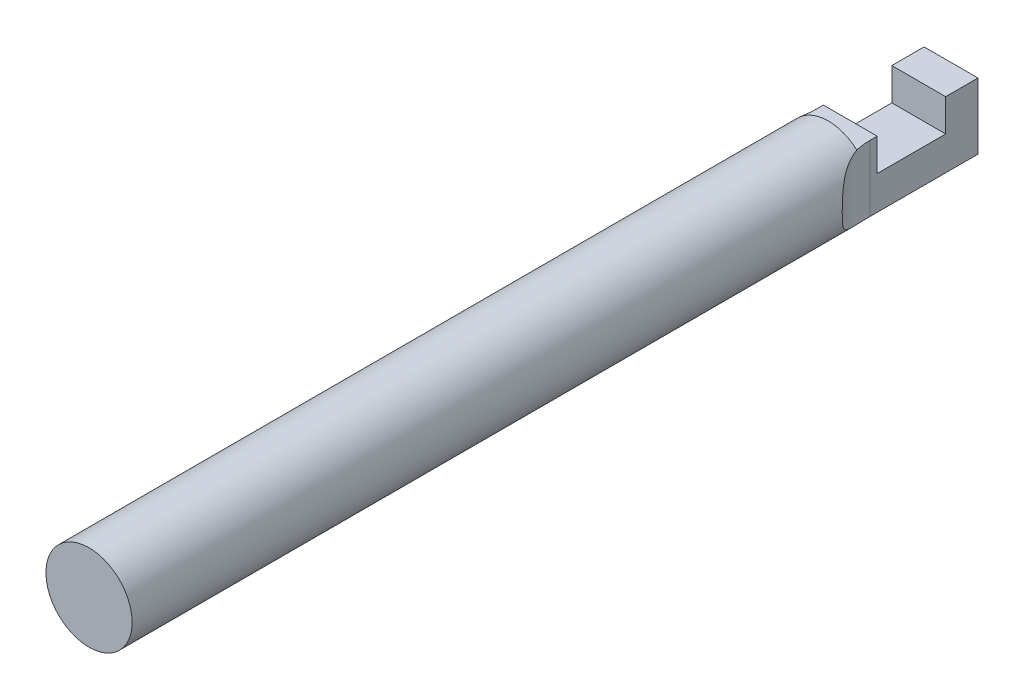
from build123d import *

# Parameters (mm, degrees)
SKETCH1_W               = 40
SKETCH1_H               = 2
CUT_EXTRUDE1_DEPTH      = 41.099875312
CUT_EXTRUDE1_DEPTH_BACK = 41.099875312
CUT_EXTRUDE2_START      = 1.5
SKETCH3_W               = 4
SKETCH3_H               = 5.7
CUT_EXTRUDE2_DEPTH      = 39.599875421
SKETCH4_W               = 2.5
SKETCH4_H               = 3.175
CUT_EXTRUDE3_DEPTH      = 41.099875421


with BuildPart() as part:
    # Sketch1 → Revolve1 (revolve)
    with BuildSketch(Plane(origin=(0, 0, 0), x_dir=(0, 0, -1), z_dir=(1, 0, 0))):
        with Locations((-20, 1)):
            Rectangle(SKETCH1_W, SKETCH1_H)
    revolve(axis=Axis((0, 0, -0.721189591), (0, 0, -1)))

    # Sketch2 → Cut-Extrude1 (cut, two sides: drawn at the far end of the back side and taken through both)
    with BuildSketch(Plane(origin=(0, 0, 0), x_dir=(1, 0, 0), z_dir=(0, 1, 0)).offset(-CUT_EXTRUDE1_DEPTH_BACK)):
        with BuildLine():
            Line((-1.25, 0), (-1.25, -5))
            ThreePointArc((-1.25, -5), (-2.17993597, -7.24506403), (-4.425, -8.175))
            Line((-4.425, -8.175), (-4.425, 0))
            Line((-4.425, 0), (-1.25, 0))
        make_face()
        with BuildLine():
            Line((1.25, 0), (1.25, -5))
            ThreePointArc((1.25, -5), (2.17993597, -7.24506403), (4.425, -8.175))
            Line((4.425, -8.175), (4.425, 0))
            Line((4.425, 0), (1.25, 0))
        make_face()
    extrude(amount=CUT_EXTRUDE1_DEPTH + CUT_EXTRUDE1_DEPTH_BACK, mode=Mode.SUBTRACT)

    # Sketch3 → Cut-Extrude2 (cut, through all)
    with BuildSketch(Plane(origin=(0, 0, 0), x_dir=(1, 0, 0), z_dir=(0, 1, 0)).offset(CUT_EXTRUDE2_START)):
        with Locations((0, -2.85)):
            Rectangle(SKETCH3_W, SKETCH3_H)
    extrude(amount=CUT_EXTRUDE2_DEPTH, mode=Mode.SUBTRACT)

    # Sketch4 → Cut-Extrude3 (cut, through all)
    with BuildSketch(Plane(origin=(0, 0, 0), x_dir=(1, 0, 0), z_dir=(0, 1, 0))):
        with Locations((0, -3.0875)):
            Rectangle(SKETCH4_W, SKETCH4_H)
    extrude(amount=CUT_EXTRUDE3_DEPTH, mode=Mode.SUBTRACT)


solid = part.part
